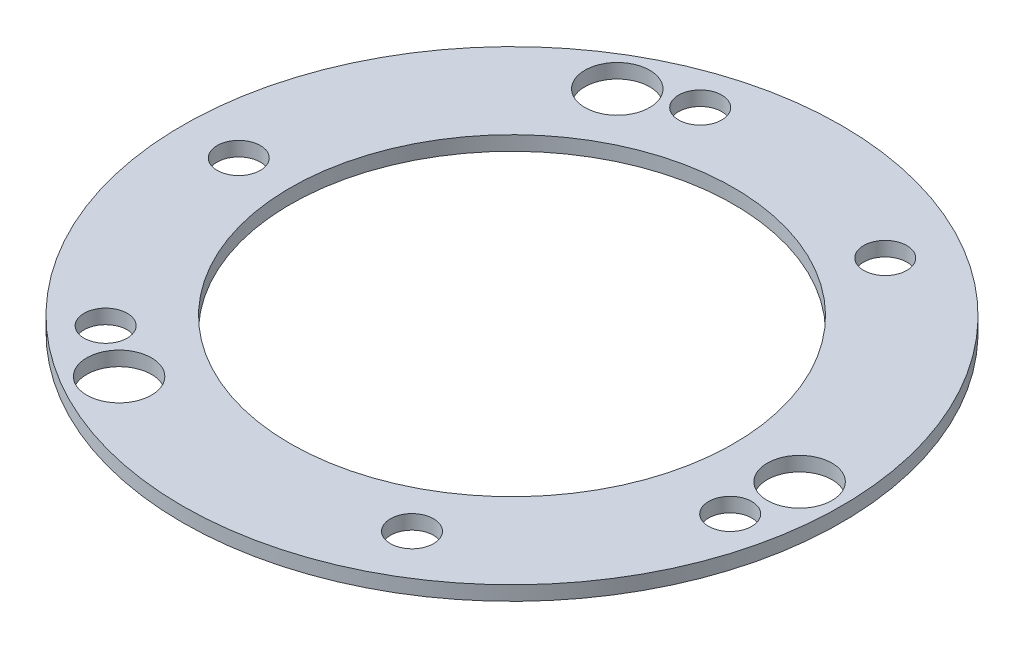
from build123d import *

# Parameters (mm, degrees)
SKETCH_3_R               = 275
SKETCH_3_R_2             = 185
SKETCH_3_R_3             = 27
SKETCH_3_R_4             = 18
EXTRUDE_1_DEPTH          = 12
CUT_EXTRUDE_2_DEPTH      = 12
CUT_EXTRUDE_2_DEPTH_BACK = 390.093819021
SKETCH_4_R               = 18


with BuildPart() as part:
    # 草图3 → 凸台-拉伸1 (new body)
    with BuildSketch(Plane(origin=(0, 0, 0), x_dir=(1, 0, 0), z_dir=(0, 1, 0))):
        with Locations(Location((0, 0, 0), (0, 0, 270))):
            Circle(SKETCH_3_R)
        with Locations(Location((0, 0, 0), (0, 0, 270))):
            Circle(SKETCH_3_R_2, mode=Mode.SUBTRACT)
        with Locations(Location((240, 0, 0), (0, 0, 270))):
            Circle(SKETCH_3_R_3, mode=Mode.SUBTRACT)
        with Locations(Location((234.2578125, -52.185029297, 0), (0, 0, 270))):
            Circle(SKETCH_3_R_4, mode=Mode.SUBTRACT)
        with Locations(Location((-120, -207.846096908, 0), (0, 0, 270))):
            Circle(SKETCH_3_R_3, mode=Mode.SUBTRACT)
        with Locations(Location((-120, 207.846096908, 0), (0, 0, 270))):
            Circle(SKETCH_3_R_3, mode=Mode.SUBTRACT)
        with Locations(Location((-71.935345182, 228.965731308, 0), (0, 0, 270))):
            Circle(SKETCH_3_R_4, mode=Mode.SUBTRACT)
        with Locations(Location((-162.322467318, -176.780702012, 0), (0, 0, 270))):
            Circle(SKETCH_3_R_4, mode=Mode.SUBTRACT)
    extrude(amount=EXTRUDE_1_DEPTH)

    # 草图4 → 切除-拉伸2 (cut, two sides: drawn at the far end of the back side and taken through both)
    with BuildSketch(Plane(origin=(0, 0, 0), x_dir=(1, 0, 0), z_dir=(0, 1, 0)).offset(-CUT_EXTRUDE_2_DEPTH_BACK)):
        with Locations(Location((-228, 0, 0), (0, 0, 270))):
            Circle(SKETCH_4_R)
        with Locations(Location((114, 197.453792063, 0), (0, 0, 270))):
            Circle(SKETCH_4_R)
        with Locations(Location((114, -197.453792063, 0), (0, 0, 270))):
            Circle(SKETCH_4_R)
    extrude(amount=CUT_EXTRUDE_2_DEPTH + CUT_EXTRUDE_2_DEPTH_BACK, mode=Mode.SUBTRACT)


solid = part.part
